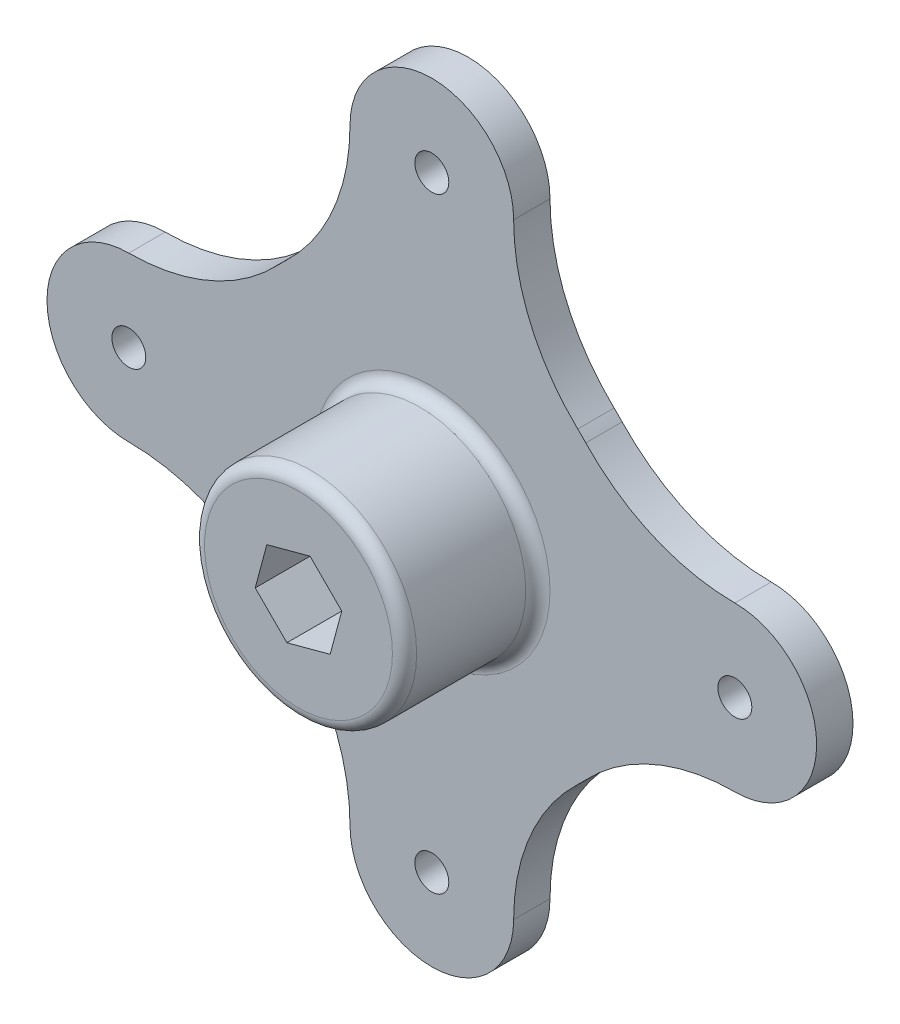
from build123d import *

# Parameters (mm, degrees)
SKETCH2_R           = 8.75
BOSS_EXTRUDE1_DEPTH = 14
SKETCH3_R           = 1.4
BOSS_EXTRUDE2_DEPTH = 3
FILLET1_R           = 1
CUT_EXTRUDE2_REACH  = 49.033


with BuildPart() as part:
    # Sketch2 → Boss-Extrude1 (new body)
    with BuildSketch(Plane.XY):
        Circle(SKETCH2_R)
    extrude(amount=BOSS_EXTRUDE1_DEPTH)

    # Sketch3 → Boss-Extrude2 (add)
    with BuildSketch(Plane.XY):
        with BuildLine():
            ThreePointArc((-12.038357667, -12.701493797), (-12.374368671, -12.374368671), (-12.701493797, -12.038357667))
            ThreePointArc((-12.701493797, -12.038357667), (-18.306346632, -8.128131702), (-25, -6.75))
            ThreePointArc((-25, -6.75), (-31.75, 0), (-25, 6.75))
            ThreePointArc((-25, 6.75), (-18.306346632, 8.128131702), (-12.701493797, 12.038357667))
            ThreePointArc((-12.701493797, 12.038357667), (-12.374368671, 12.374368671), (-12.038357667, 12.701493797))
            ThreePointArc((-12.038357667, 12.701493797), (-8.128131702, 18.306346632), (-6.75, 25))
            ThreePointArc((-6.75, 25), (0, 31.75), (6.75, 25))
            ThreePointArc((6.75, 25), (8.128131702, 18.306346632), (12.038357667, 12.701493797))
            ThreePointArc((12.038357667, 12.701493797), (12.374368671, 12.374368671), (12.701493797, 12.038357667))
            ThreePointArc((12.701493797, 12.038357667), (18.306346632, 8.128131702), (25, 6.75))
            ThreePointArc((25, 6.75), (31.75, 0), (25, -6.75))
            ThreePointArc((25, -6.75), (18.306346632, -8.128131702), (12.701493797, -12.038357667))
            ThreePointArc((12.701493797, -12.038357667), (12.374368671, -12.374368671), (12.038357667, -12.701493797))
            ThreePointArc((12.038357667, -12.701493797), (8.128131702, -18.306346632), (6.75, -25))
            ThreePointArc((6.75, -25), (0, -31.75), (-6.75, -25))
            ThreePointArc((-6.75, -25), (-8.128131702, -18.306346632), (-12.038357667, -12.701493797))
        make_face()
        with Locations((25, 0)):
            Circle(SKETCH3_R, mode=Mode.SUBTRACT)
        with Locations((0, -25)):
            Circle(SKETCH3_R, mode=Mode.SUBTRACT)
        with Locations((-25, 0)):
            Circle(SKETCH3_R, mode=Mode.SUBTRACT)
        with Locations((0, 25)):
            Circle(SKETCH3_R, mode=Mode.SUBTRACT)
    extrude(amount=BOSS_EXTRUDE2_DEPTH)

    # Fillet1
    fillet1_edges = [part.edges().sort_by_distance(p)[0] for p in [
        (-8.75, 0, 14),
        (-8.75, 0, 3),
    ]]
    fillet(fillet1_edges, radius=FILLET1_R)

    # Sketch1 → Cut-Extrude2 (cut, up to next)
    with BuildSketch(Plane.XY, mode=Mode.PRIVATE) as cut_extrude2_sk1:
        Polygon((2.612789059, -2.612789059), (3.569136229, 0.95634717), (0.95634717, 3.569136229), (-2.612789059, 2.612789059), (-3.569136229, -0.95634717), (-0.95634717, -3.569136229), align=None)
    cut_extrude2_tool1 = extrude(cut_extrude2_sk1.sketch, amount=CUT_EXTRUDE2_REACH, mode=Mode.PRIVATE) & part.part
    add(cut_extrude2_tool1.solids().sort_by_distance((0, 0, 0))[0], mode=Mode.SUBTRACT)


solid = part.part
